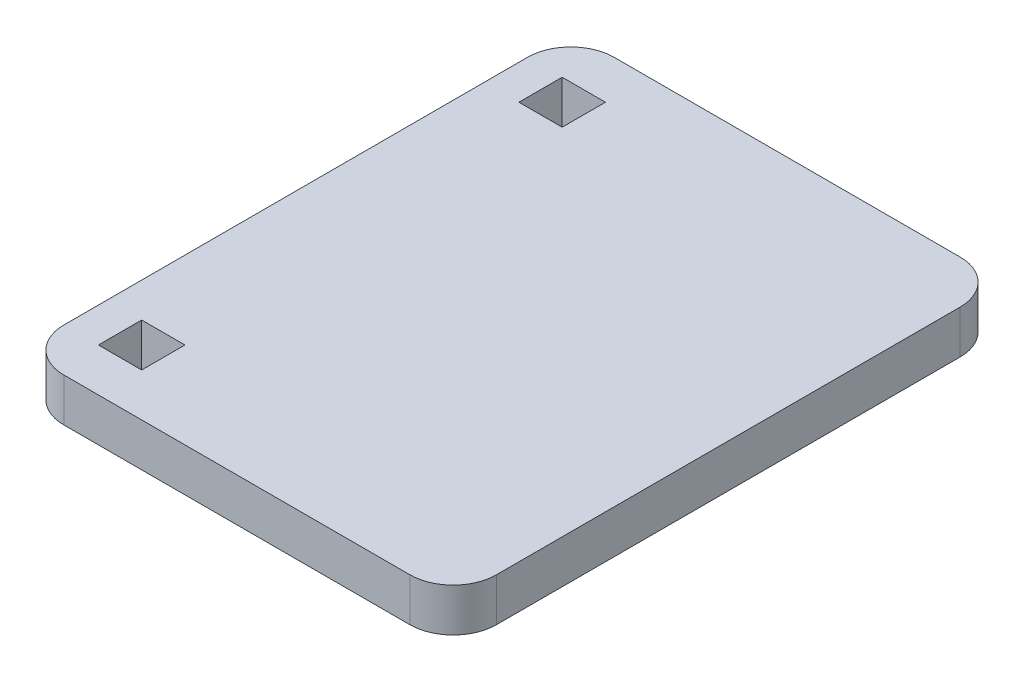
from build123d import *

# Parameters (mm, degrees)
SKETCH2_W           = 5
SKETCH2_H           = 5
BOSS_EXTRUDE1_DEPTH = 5


with BuildPart() as part:
    # Sketch2 → Boss-Extrude1 (new body)
    with BuildSketch(Plane(origin=(0, 0, 0), x_dir=(1, 0, 0), z_dir=(0, 1, 0))):
        with BuildLine():
            Line((5, 0), (45, 0))
            ThreePointArc((45, 0), (48.535533906, -1.464466094), (50, -5))
            Line((50, -5), (50, -58.6))
            ThreePointArc((50, -58.6), (48.535533906, -62.135533906), (45, -63.6))
            Line((45, -63.6), (5, -63.6))
            ThreePointArc((5, -63.6), (1.464466094, -62.135533906), (0, -58.6))
            Line((0, -58.6), (0, -5))
            ThreePointArc((0, -5), (1.464466094, -1.464466094), (5, 0))
        make_face()
        with Locations((6.5, -56.1)):
            Rectangle(SKETCH2_W, SKETCH2_H, mode=Mode.SUBTRACT)
        with Locations((6.5, -7.5)):
            Rectangle(SKETCH2_W, SKETCH2_H, mode=Mode.SUBTRACT)
    extrude(amount=BOSS_EXTRUDE1_DEPTH)


solid = part.part
